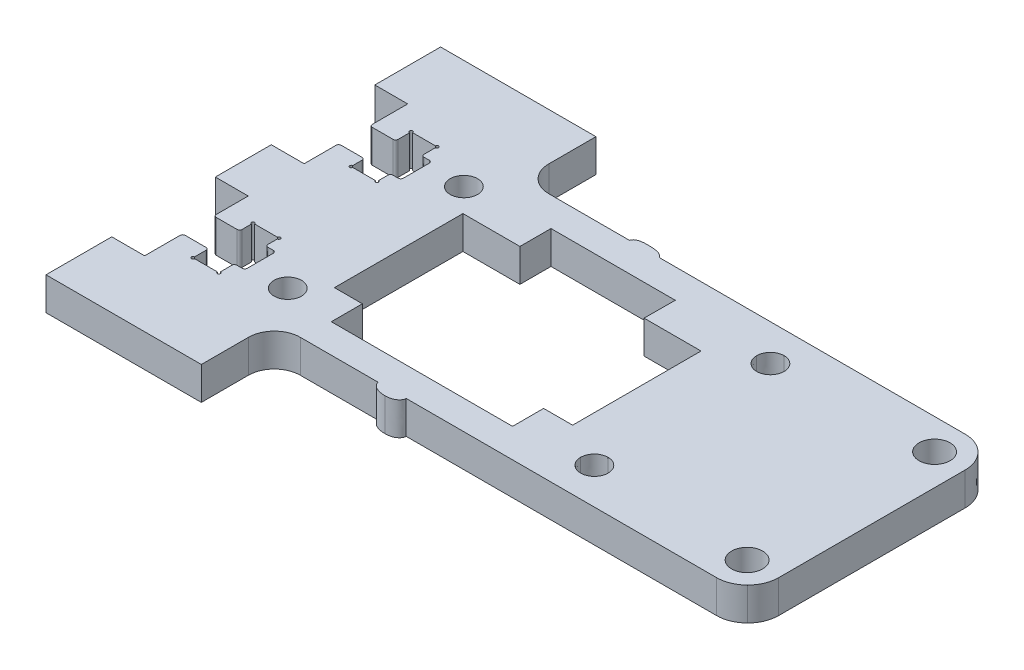
from build123d import *

# Parameters (mm, degrees)
SKETCH2_R           = 1.5001
SKETCH2_R_2         = 1.4999
SKETCH2_R_3         = 1.325
SKETCH2_R_4         = 1.325100015
BOSS_EXTRUDE1_DEPTH = 3.175


with BuildPart() as part:
    # Sketch2 → Boss-Extrude1 (new body)
    with BuildSketch(Plane(origin=(0, 0, 0), x_dir=(1, 0, 0), z_dir=(0, 1, 0))):
        with BuildLine():
            Line((94.626760584, 60.308838669), (87.110460584, 60.308838669))
            ThreePointArc((87.110460584, 60.308838669), (85.342693631, 59.576605622), (84.610460584, 57.808838669))
            Line((84.610460584, 57.808838669), (84.610460584, 53.258838669))
            Line((84.610460584, 53.258838669), (69.610460584, 53.258838669))
            Line((69.610460584, 53.258838669), (69.610460584, 59.608838669))
            Line((69.610460584, 59.608838669), (72.785460584, 59.608838669))
            Line((72.785460584, 59.608838669), (72.785460584, 63.026427795))
            ThreePointArc((72.785460584, 63.026427795), (72.858683889, 63.20320449), (73.035460584, 63.276427795))
            Line((73.035460584, 63.276427795), (75.035460584, 63.276427795))
            ThreePointArc((75.035460584, 63.276427795), (75.21223728, 63.20320449), (75.285460584, 63.026427795))
            Line((75.285460584, 63.026427795), (75.285460584, 61.980589301))
            Line((75.285460584, 61.980589301), (75.285460584, 61.92643317))
            ThreePointArc((75.285460584, 61.92643317), (75.179394567, 61.670367153), (75.435460584, 61.77643317))
            Line((75.435460584, 61.77643317), (75.545268206, 61.77643317))
            Line((75.545268206, 61.77643317), (77.635460584, 61.77643317))
            ThreePointArc((77.635460584, 61.77643317), (77.891526602, 61.670367153), (77.785460584, 61.92643317))
            Line((77.785460584, 61.92643317), (77.785460584, 61.980589301))
            Line((77.785460584, 61.980589301), (77.785460584, 63.026427795))
            ThreePointArc((77.785460584, 63.026427795), (77.858683889, 63.20320449), (78.035460584, 63.276427795))
            Line((78.035460584, 63.276427795), (78.535460584, 63.276427795))
            ThreePointArc((78.535460584, 63.276427795), (78.71223728, 63.349651099), (78.785460584, 63.526427795))
            Line((78.785460584, 63.526427795), (78.785460584, 66.026427795))
            ThreePointArc((78.785460584, 66.026427795), (78.71223728, 66.20320449), (78.535460584, 66.276427795))
            Line((78.535460584, 66.276427795), (78.035460584, 66.276427795))
            ThreePointArc((78.035460584, 66.276427795), (77.858683889, 66.349651099), (77.785460584, 66.526427795))
            Line((77.785460584, 66.526427795), (77.785460584, 67.35143317))
            Line((77.785460584, 67.35143317), (77.785460584, 67.42643317))
            ThreePointArc((77.785460584, 67.42643317), (77.891526602, 67.682499187), (77.635460584, 67.57643317))
            Line((77.635460584, 67.57643317), (75.545268206, 67.57643317))
            Line((75.545268206, 67.57643317), (75.435460584, 67.57643317))
            ThreePointArc((75.435460584, 67.57643317), (75.179394567, 67.682499187), (75.285460584, 67.42643317))
            Line((75.285460584, 67.42643317), (75.285460584, 67.35143317))
            Line((75.285460584, 67.35143317), (75.285460584, 66.526427795))
            ThreePointArc((75.285460584, 66.526427795), (75.21223728, 66.349651099), (75.035460584, 66.276427795))
            Line((75.035460584, 66.276427795), (73.035460584, 66.276427795))
            ThreePointArc((73.035460584, 66.276427795), (72.858683889, 66.349651099), (72.785460584, 66.526427795))
            Line((72.785460584, 66.526427795), (72.785460584, 69.608838669))
            Line((72.785460584, 69.608838669), (69.610460584, 69.608838669))
            Line((69.610460584, 69.608838669), (69.610460584, 75.008838669))
            Line((69.610460584, 75.008838669), (72.785460584, 75.008838669))
            Line((72.785460584, 75.008838669), (72.785460584, 78.091249543))
            ThreePointArc((72.785460584, 78.091249543), (72.858683889, 78.268026238), (73.035460584, 78.341249543))
            Line((73.035460584, 78.341249543), (75.035460584, 78.341249543))
            ThreePointArc((75.035460584, 78.341249543), (75.21223728, 78.268026238), (75.285460584, 78.091249543))
            Line((75.285460584, 78.091249543), (75.285460584, 77.266244167))
            Line((75.285460584, 77.266244167), (75.285460584, 77.191244167))
            ThreePointArc((75.285460584, 77.191244167), (75.179394567, 76.93517815), (75.435460584, 77.041244167))
            Line((75.435460584, 77.041244167), (75.545268206, 77.041244167))
            Line((75.545268206, 77.041244167), (77.635460584, 77.041244167))
            ThreePointArc((77.635460584, 77.041244167), (77.891526602, 76.93517815), (77.785460584, 77.191244167))
            Line((77.785460584, 77.191244167), (77.785460584, 77.266244167))
            Line((77.785460584, 77.266244167), (77.785460584, 78.091249543))
            ThreePointArc((77.785460584, 78.091249543), (77.858683889, 78.268026238), (78.035460584, 78.341249543))
            Line((78.035460584, 78.341249543), (78.535460584, 78.341249543))
            ThreePointArc((78.535460584, 78.341249543), (78.71223728, 78.414472847), (78.785460584, 78.591249543))
            Line((78.785460584, 78.591249543), (78.785460584, 81.091249543))
            ThreePointArc((78.785460584, 81.091249543), (78.71223728, 81.268026238), (78.535460584, 81.341249543))
            Line((78.535460584, 81.341249543), (78.035460584, 81.341249543))
            ThreePointArc((78.035460584, 81.341249543), (77.858683889, 81.414472847), (77.785460584, 81.591249543))
            Line((77.785460584, 81.591249543), (77.785460584, 82.637088037))
            Line((77.785460584, 82.637088037), (77.785460584, 82.691244167))
            ThreePointArc((77.785460584, 82.691244167), (77.891526602, 82.947310184), (77.635460584, 82.841244167))
            Line((77.635460584, 82.841244167), (75.545268206, 82.841244167))
            Line((75.545268206, 82.841244167), (75.435460584, 82.841244167))
            ThreePointArc((75.435460584, 82.841244167), (75.179394567, 82.947310184), (75.285460584, 82.691244167))
            Line((75.285460584, 82.691244167), (75.285460584, 82.637088037))
            Line((75.285460584, 82.637088037), (75.285460584, 81.591249543))
            ThreePointArc((75.285460584, 81.591249543), (75.21223728, 81.414472847), (75.035460584, 81.341249543))
            Line((75.035460584, 81.341249543), (73.035460584, 81.341249543))
            ThreePointArc((73.035460584, 81.341249543), (72.858683889, 81.414472847), (72.785460584, 81.591249543))
            Line((72.785460584, 81.591249543), (72.785460584, 85.008838669))
            Line((72.785460584, 85.008838669), (69.610460584, 85.008838669))
            Line((69.610460584, 85.008838669), (69.610460584, 91.358838669))
            Line((69.610460584, 91.358838669), (84.610460584, 91.358838669))
            Line((84.610460584, 91.358838669), (84.610460584, 86.808838669))
            ThreePointArc((84.610460584, 86.808838669), (85.342693631, 85.041071716), (87.110460584, 84.308838669))
            Line((87.110460584, 84.308838669), (94.917760584, 84.308838669))
            add(Edge.make_bspline(
                [(96.110460584, 84.812738669), (94.998360584, 84.812738669), (94.917760584, 84.308838669)],
                knots=[0.588235294, 0.588235294, 0.588235294, 0.647058824, 0.647058824, 0.647058824], degree=2))
            add(Edge.make_bspline(
                [(98.030760584, 84.308838669), (97.383160584, 84.308838669), (97.963460584, 84.812738669), (96.110460584, 84.812738669)],
                knots=[0.529411765, 0.529411765, 0.529411765, 0.529411765, 0.588235294, 0.588235294, 0.588235294, 0.588235294], degree=3))
            add(Edge.make_bspline(
                [(127.310460584, 84.308838669), (106.143660584, 84.308838669), (98.030760584, 84.308838669)],
                knots=[0.470588235, 0.470588235, 0.470588235, 0.529411765, 0.529411765, 0.529411765], degree=2))
            add(Edge.make_bspline(
                [(129.431660584, 83.430138669), (128.869060584, 83.992738669), (128.106060584, 84.308838669), (127.310460584, 84.308838669)],
                knots=[0.411764706, 0.411764706, 0.411764706, 0.411764706, 0.470588235, 0.470588235, 0.470588235, 0.470588235], degree=3))
            add(Edge.make_bspline(
                [(130.310460584, 81.308838669), (130.310460584, 82.104438669), (129.994260584, 82.867538669), (129.431660584, 83.430138669)],
                knots=[0.352941176, 0.352941176, 0.352941176, 0.352941176, 0.411764706, 0.411764706, 0.411764706, 0.411764706], degree=3))
            Line((130.310460584, 81.308838669), (130.310460578, 63.308111963))
            add(Edge.make_bspline(
                [(129.431660578, 61.186711963), (129.994260578, 61.749311963), (130.310460578, 62.512411963), (130.310460578, 63.308111963)],
                knots=[0.235294118, 0.235294118, 0.235294118, 0.235294118, 0.294117647, 0.294117647, 0.294117647, 0.294117647], degree=3))
            add(Edge.make_bspline(
                [(127.310460578, 60.308111963), (128.106060578, 60.308111963), (128.869060578, 60.624111963), (129.431660578, 61.186711963)],
                knots=[0.176470588, 0.176470588, 0.176470588, 0.176470588, 0.235294118, 0.235294118, 0.235294118, 0.235294118], degree=3))
            Line((127.310460578, 60.308111963), (97.281160599, 60.309219696))
            add(Edge.make_bspline(
                [(96.110574922, 59.51255169), (97.22447491, 59.512711553), (97.450360597, 60.309243979), (97.281160599, 60.309219696)],
                knots=[0.058823529, 0.058823529, 0.058823529, 0.058823529, 0.117647059, 0.117647059, 0.117647059, 0.117647059], degree=3))
            add(Edge.make_bspline(
                [(94.626760584, 60.308838669), (94.626860584, 60.308838683), (94.749674936, 59.512356307), (96.110574922, 59.51255169)],
                knots=[0, 0, 0, 0, 0.058823529, 0.058823529, 0.058823529, 0.058823529], degree=3))
        make_face()
        with Locations(Location((127.310460584, 81.358637226, 0), (0, 0, 270))):
            Circle(SKETCH2_R, mode=Mode.SUBTRACT)
        with Locations(Location((127.310460584, 63.258737226, 0), (0, 0, 270))):
            Circle(SKETCH2_R_2, mode=Mode.SUBTRACT)
        with Locations(Location((82.410260584, 63.808637226, 0), (0, 0, 270))):
            Circle(SKETCH2_R_3, mode=Mode.SUBTRACT)
        with Locations(Location((82.410460584, 80.808637226, 0), (0, 0, 270))):
            Circle(SKETCH2_R_4, mode=Mode.SUBTRACT)
        Polygon((104.860460586, 66.108940112), (104.810231878, 66.108940112), (104.810176544, 63.108838669), (87.310176544, 63.108838669), (87.310231876, 66.10880554), (84.610231876, 66.108842888), (84.620460999, 78.508838669), (90.120460999, 78.508838669), (90.120460999, 81.508838669), (102.120460999, 81.508838669), (102.110460584, 78.508855337), (107.610460584, 78.508838669), (107.610460584, 66.108838669), align=None, mode=Mode.SUBTRACT)
        with BuildLine():
            add(Edge.make_bspline(
                [(110.685260584, 63.808637226), (110.685260584, 63.076837226), (111.278560584, 62.483537226), (112.010160584, 62.483537226)],
                knots=[0, 0, 0, 0, 0.2, 0.2, 0.2, 0.2], degree=3))
            add(Edge.make_bspline(
                [(112.010160584, 62.483537226), (112.742060584, 62.483537226), (113.335260584, 63.076837226), (113.335260584, 63.808537226)],
                knots=[0.2, 0.2, 0.2, 0.2, 0.4, 0.4, 0.4, 0.4], degree=3))
            add(Edge.make_bspline(
                [(113.335260584, 63.808537226), (113.335260584, 64.540337226), (112.742060584, 65.133537226), (112.010360584, 65.133537226)],
                knots=[0.4, 0.4, 0.4, 0.4, 0.6, 0.6, 0.6, 0.6], degree=3))
            add(Edge.make_bspline(
                [(112.010360584, 65.133537226), (111.278560584, 65.133537226), (110.685260584, 64.540337226), (110.685260584, 63.808637226)],
                knots=[0.6, 0.6, 0.6, 0.6, 1, 1, 1, 1], degree=3))
        make_face(mode=Mode.SUBTRACT)
        with BuildLine():
            add(Edge.make_bspline(
                [(110.685260584, 80.808537226), (110.685260584, 80.076737226), (111.278560584, 79.483437226), (112.010160584, 79.483437226)],
                knots=[0, 0, 0, 0, 0.2, 0.2, 0.2, 0.2], degree=3))
            add(Edge.make_bspline(
                [(112.010160584, 79.483437226), (112.742060584, 79.483437226), (113.335260584, 80.076737226), (113.335260584, 80.808437226)],
                knots=[0.2, 0.2, 0.2, 0.2, 0.4, 0.4, 0.4, 0.4], degree=3))
            add(Edge.make_bspline(
                [(113.335260584, 80.808437226), (113.335260584, 81.540237226), (112.742060584, 82.133437226), (112.010360584, 82.133437226)],
                knots=[0.4, 0.4, 0.4, 0.4, 0.6, 0.6, 0.6, 0.6], degree=3))
            add(Edge.make_bspline(
                [(112.010360584, 82.133437226), (111.278560584, 82.133437226), (110.685260584, 81.540237226), (110.685260584, 80.808537226)],
                knots=[0.6, 0.6, 0.6, 0.6, 1, 1, 1, 1], degree=3))
        make_face(mode=Mode.SUBTRACT)
    extrude(amount=BOSS_EXTRUDE1_DEPTH)


solid = part.part
